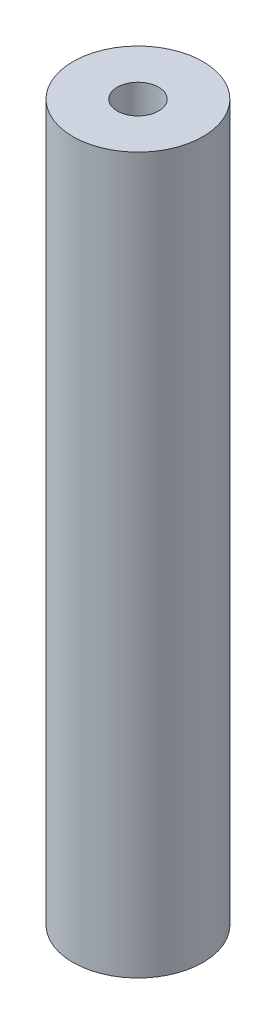
from build123d import *

# Parameters (mm, degrees)
SKETCH1_R           = 6.35
SKETCH1_R_2         = 2.0193
BOSS_EXTRUDE1_DEPTH = 69.85


with BuildPart() as part:
    # Sketch1 → Boss-Extrude1 (new body)
    with BuildSketch(Plane(origin=(0, 0, 0), x_dir=(1, 0, 0), z_dir=(0, 1, 0))):
        with Locations(Location((0, 0, 0), (0, 0, 270))):
            Circle(SKETCH1_R)
        with Locations(Location((0, 0, 0), (0, 0, 270))):
            Circle(SKETCH1_R_2, mode=Mode.SUBTRACT)
    extrude(amount=BOSS_EXTRUDE1_DEPTH)


solid = part.part
